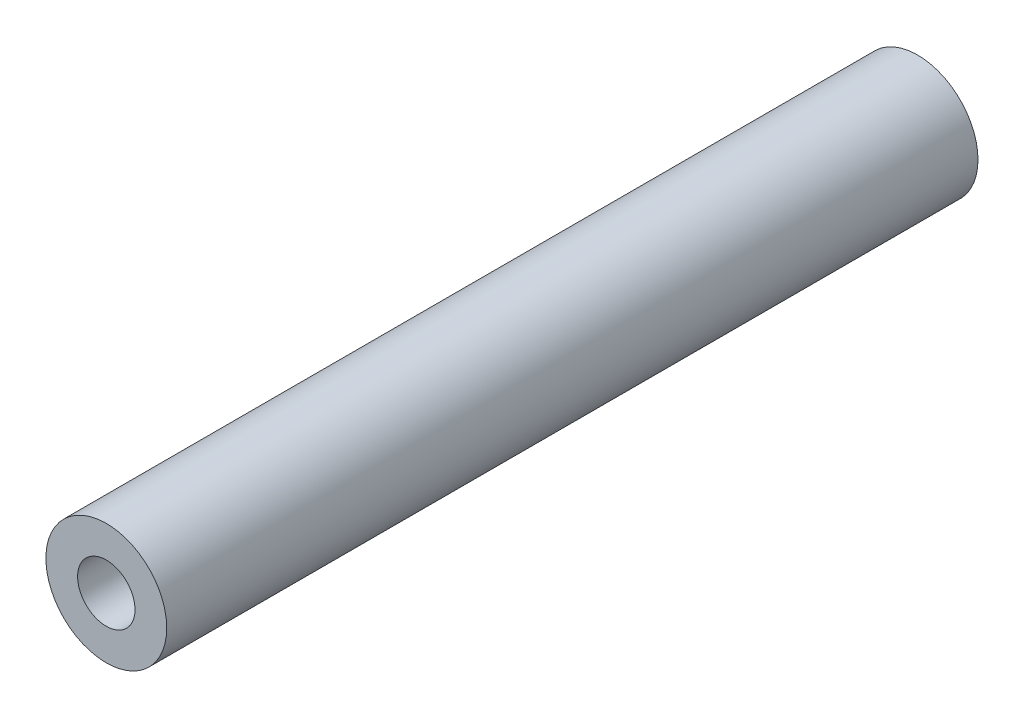
from build123d import *

# Parameters (mm, degrees)
S01_ANNULAR_SECTION_R      = 7
S01_ANNULAR_SECTION_R_2    = 3.325
F_01_ANNULAR_SECTION_DEPTH = 94


with BuildPart() as part:
    # S01 - Annular section → 01 - Annular section (new body)
    with BuildSketch(Plane.XY):
        Circle(S01_ANNULAR_SECTION_R)
        Circle(S01_ANNULAR_SECTION_R_2, mode=Mode.SUBTRACT)
    extrude(amount=F_01_ANNULAR_SECTION_DEPTH)


solid = part.part
